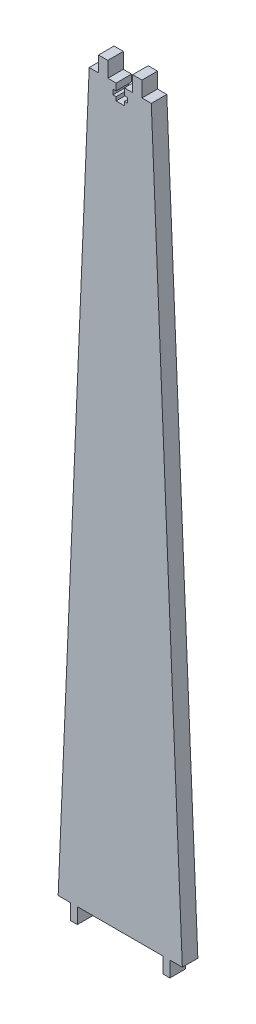
from build123d import *

# Parameters (mm, degrees)
BOSS_EXTRUDE1_DEPTH = 6.35


with BuildPart() as part:
    # Sketch1 → Boss-Extrude1 (new body)
    with BuildSketch(Plane.XY):
        Polygon((25.4, 0), (12.7, 299.72), (8.89, 299.72), (8.89, 306.07), (5.08, 306.07), (5.08, 299.72), (1.7, 299.72), (1.7, 296.926), (2.97, 296.926), (2.97, 294.894), (1.7, 294.894), (1.7, 293.37), (-1.7, 293.37), (-1.7, 294.894), (-2.97, 294.894), (-2.97, 296.926), (-1.7, 296.926), (-1.7, 299.72), (-5.08, 299.72), (-5.08, 306.07), (-8.89, 306.07), (-8.89, 299.72), (-12.7, 299.72), (-25.4, 0), (-20.32, 0), (-20.32, -6.35), (-17.526, -6.35), (-17.526, 0), (17.526, 0), (17.526, -6.35), (20.32, -6.35), (20.32, 0), align=None)
    extrude(amount=BOSS_EXTRUDE1_DEPTH)


solid = part.part
